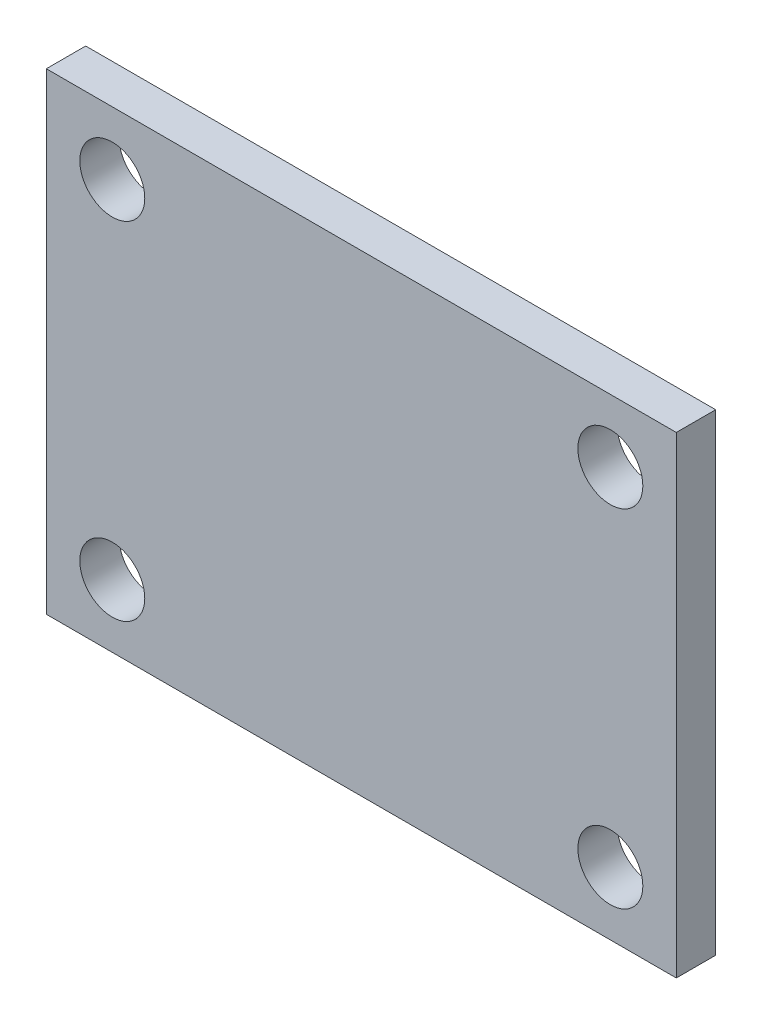
from build123d import *

# Parameters (mm, degrees)
SKETCH1_W           = 32
SKETCH1_H           = 24
SKETCH1_R           = 1.65
BOSS_EXTRUDE1_DEPTH = 2


with BuildPart() as part:
    # Sketch1 → Boss-Extrude1 (new body)
    with BuildSketch(Plane.XY):
        Rectangle(SKETCH1_W, SKETCH1_H)
        with Locations((-12.65, 8.8)):
            Circle(SKETCH1_R, mode=Mode.SUBTRACT)
        with Locations((12.65, 8.8)):
            Circle(SKETCH1_R, mode=Mode.SUBTRACT)
        with Locations((12.65, -8.8)):
            Circle(SKETCH1_R, mode=Mode.SUBTRACT)
        with Locations((-12.65, -8.8)):
            Circle(SKETCH1_R, mode=Mode.SUBTRACT)
    extrude(amount=BOSS_EXTRUDE1_DEPTH)


solid = part.part
